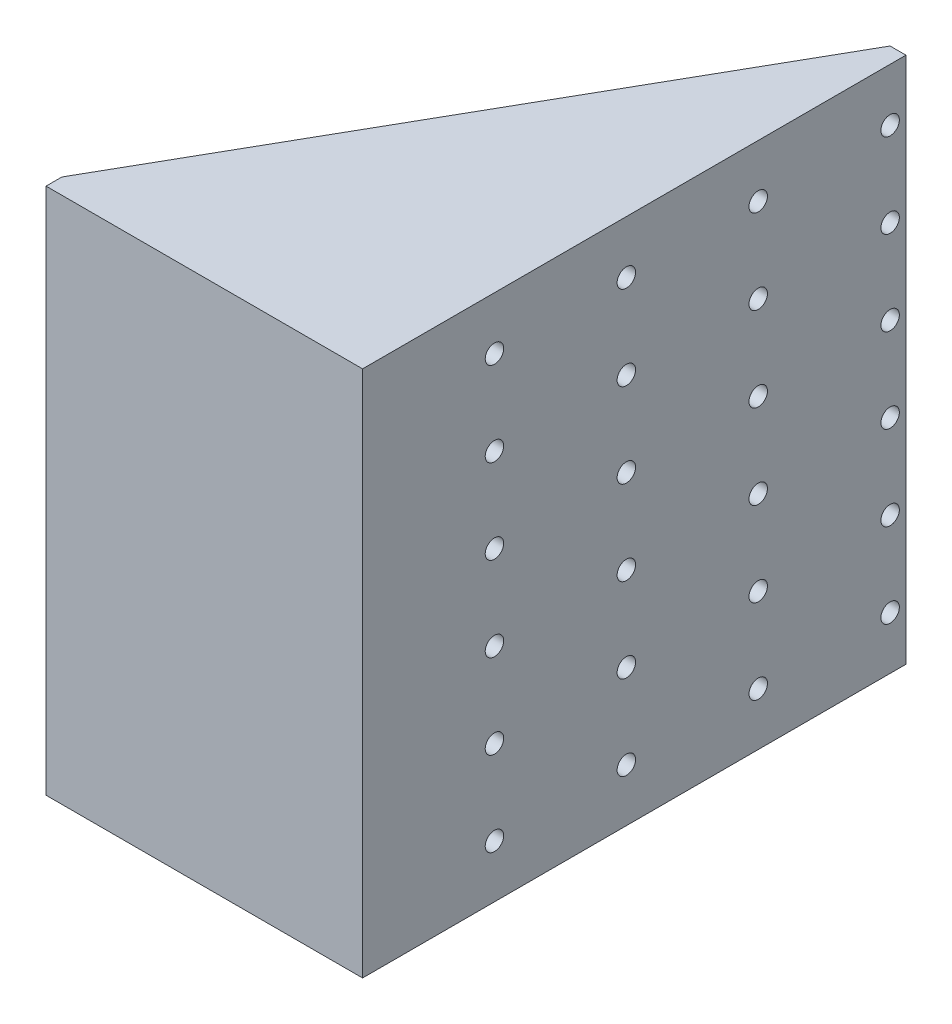
from build123d import *

# Parameters (mm, degrees)
BOSS_EXTRUDE1_DEPTH = 100
BOSS_EXTRUDE2_DEPTH = 4
LPATTERN1_COUNT     = 7
LPATTERN1_PITCH     = 16
SKETCH3_R           = 1.75
CUT_EXTRUDE1_DEPTH  = 10


with BuildPart() as part:
    # Sketch1 → Boss-Extrude1 (new body)
    with BuildSketch(Plane(origin=(0, 0, 0), x_dir=(1, 0, 0), z_dir=(0, 1, 0))):
        Polygon((0, 0), (-60, 0), (-60, 3), (-3, 3), (-3, 103), (0, 103), align=None)
    extrude(amount=BOSS_EXTRUDE1_DEPTH)

    # Sketch2 → Boss-Extrude2 (add)
    with BuildSketch(Plane(origin=(0, 100, 0), x_dir=(1, 0, 0), z_dir=(0, 1, 0))):
        Polygon((-60, 3), (-3, 103), (-3, 3), align=None)
    boss_extrude2 = extrude(amount=-BOSS_EXTRUDE2_DEPTH)

    # LPattern1: Boss-Extrude2 ×7
    with Locations(*[(0, -i * LPATTERN1_PITCH, 0) for i in range(1, LPATTERN1_COUNT)]):
        add(boss_extrude2)

    # Sketch3 → Cut-Extrude1 (cut)
    with BuildSketch(Plane(origin=(0, 0, 0), x_dir=(0, 0, -1), z_dir=(1, 0, 0))):
        with Locations((25, 10)):
            Circle(SKETCH3_R)
        with Locations((50, 10)):
            Circle(SKETCH3_R)
        with Locations((75, 10)):
            Circle(SKETCH3_R)
        with Locations((100, 10)):
            Circle(SKETCH3_R)
        with Locations((50, 26)):
            Circle(SKETCH3_R)
        with Locations((75, 26)):
            Circle(SKETCH3_R)
        with Locations((100, 26)):
            Circle(SKETCH3_R)
        with Locations((50, 42)):
            Circle(SKETCH3_R)
        with Locations((75, 42)):
            Circle(SKETCH3_R)
        with Locations((100, 42)):
            Circle(SKETCH3_R)
        with Locations((50, 58)):
            Circle(SKETCH3_R)
        with Locations((75, 58)):
            Circle(SKETCH3_R)
        with Locations((100, 58)):
            Circle(SKETCH3_R)
        with Locations((50, 74)):
            Circle(SKETCH3_R)
        with Locations((75, 74)):
            Circle(SKETCH3_R)
        with Locations((100, 74)):
            Circle(SKETCH3_R)
        with Locations((50, 90)):
            Circle(SKETCH3_R)
        with Locations((75, 90)):
            Circle(SKETCH3_R)
        with Locations((100, 90)):
            Circle(SKETCH3_R)
        with Locations((25, 26)):
            Circle(SKETCH3_R)
        with Locations((25, 42)):
            Circle(SKETCH3_R)
        with Locations((25, 58)):
            Circle(SKETCH3_R)
        with Locations((25, 74)):
            Circle(SKETCH3_R)
        with Locations((25, 90)):
            Circle(SKETCH3_R)
    extrude(amount=-CUT_EXTRUDE1_DEPTH, mode=Mode.SUBTRACT)


solid = part.part
